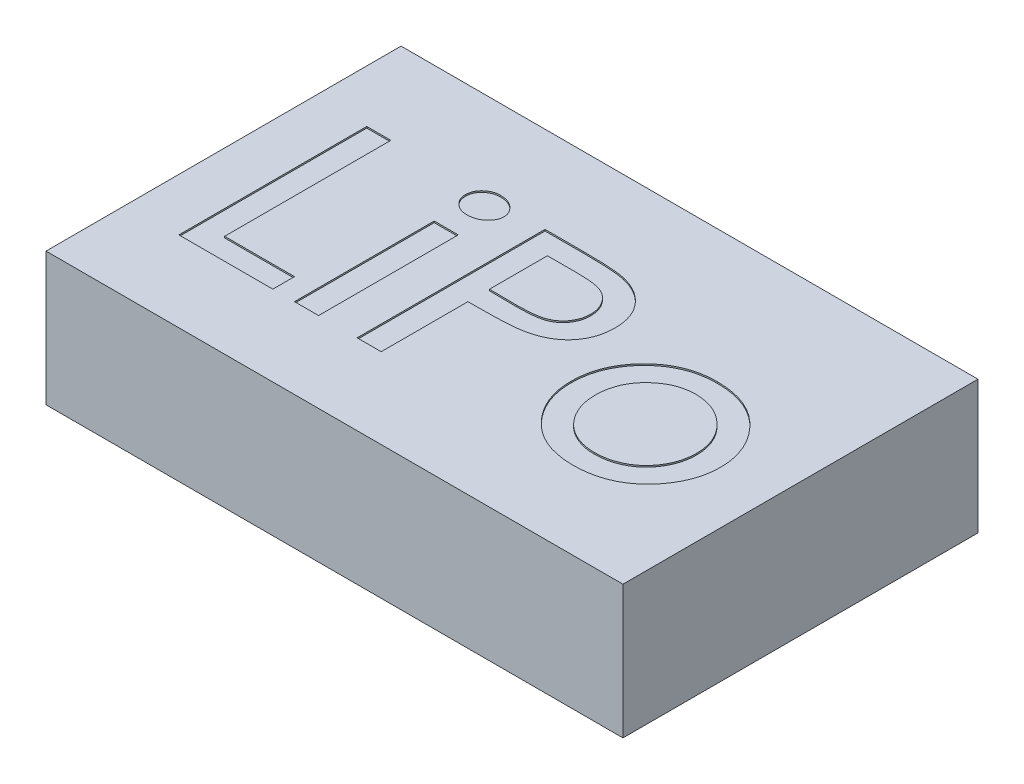
from build123d import *

# Parameters (mm, degrees)
SKETCH1_W           = 39
SKETCH1_H           = 24
BOSS_EXTRUDE1_DEPTH = 9
SKETCH2_W           = 1.628205129
SKETCH2_H           = 9.443589744
CUT_EXTRUDE1_DEPTH  = 0.1


with BuildPart() as part:
    # Sketch1 → Boss-Extrude1 (new body)
    with BuildSketch(Plane(origin=(0, 0, 0), x_dir=(1, 0, 0), z_dir=(0, 1, 0))):
        Rectangle(SKETCH1_W, SKETCH1_H)
    extrude(amount=BOSS_EXTRUDE1_DEPTH)

    # Sketch2 → Cut-Extrude1 (cut)
    # profile 1 of 5: a face of its own
    with BuildSketch(Plane(origin=(0, 9, 0), x_dir=(1, 0, 0), z_dir=(0, 1, 0))):
        Polygon((-15.955841103, 6.138342884), (-14.327635975, 6.138342884), (-14.327635975, -5.0962725), (-9.605841103, -5.0962725), (-9.605841103, -6.561657116), (-15.955841103, -6.561657116), align=None)
    # profile 2 of 5: a face of its own
    with BuildSketch(Plane(origin=(0, 9, 0), x_dir=(1, 0, 0), z_dir=(0, 1, 0))):
        with BuildLine():
            add(Edge.make_bspline(
                [(-7.412852321, 6.626804423), (-7.314947287, 6.622516885), (-7.126055311, 6.614244772), (-6.85683311, 6.54771702), (-6.616185839, 6.433306505), (-6.411180505, 6.275676826), (-6.241281957, 6.095125823), (-6.115492612, 5.900100689), (-6.039852549, 5.693335838), (-6.029118096, 5.552085378), (-6.023789821, 5.481972692)],
                knots=[0, 0, 0, 0, 1.180073081, 2.27676073, 3.320042968, 4.371717959, 5.377874923, 6.297457691, 7.154906711, 8, 8, 8, 8], degree=3))
            add(Edge.make_bspline(
                [(-6.023789821, 5.481972692), (-6.029128476, 5.412709036), (-6.039888104, 5.273113724), (-6.115478932, 5.068725668), (-6.242237258, 4.876313988), (-6.410279893, 4.695608672), (-6.617105321, 4.541182808), (-6.856704768, 4.426239487), (-7.126090975, 4.359922789), (-7.314959462, 4.351620449), (-7.412852321, 4.347317243)],
                knots=[0, 0, 0, 0, 0.838561902, 1.690053866, 2.604955955, 3.615478493, 4.665551833, 5.713360726, 6.814806749, 8, 8, 8, 8], degree=3))
            add(Edge.make_bspline(
                [(-7.412852321, 4.347317243), (-7.493941338, 4.350609069), (-7.652023482, 4.357026446), (-7.878018058, 4.425735513), (-8.088546328, 4.527203374), (-8.27435352, 4.672872337), (-8.431180106, 4.844933142), (-8.547668249, 5.040762236), (-8.615557241, 5.256259261), (-8.624422943, 5.406033992), (-8.628918026, 5.481972692)],
                knots=[0, 0, 0, 0, 1.050897616, 2.04871332, 3.044517726, 4.074156936, 5.096691018, 6.055190702, 7.01394389, 8, 8, 8, 8], degree=3))
            add(Edge.make_bspline(
                [(-8.628918026, 5.481972692), (-8.62461053, 5.559648736), (-8.616205957, 5.711206412), (-8.547003827, 5.928738293), (-8.432039544, 6.126265696), (-8.27435621, 6.298871144), (-8.087862744, 6.443782083), (-7.87805563, 6.549548832), (-7.650945016, 6.61633204), (-7.493026045, 6.623278023), (-7.412852321, 6.626804423)],
                knots=[0, 0, 0, 0, 1.003476519, 1.957934027, 2.921620235, 3.939572868, 4.964598795, 5.960849032, 6.964745478, 8, 8, 8, 8], degree=3))
        make_face()
    # profile 3 of 5: a face of its own
    with BuildSketch(Plane(origin=(0, 9, 0), x_dir=(1, 0, 0), z_dir=(0, 1, 0))):
        with Locations((-7.326353924, -1.839862244)):
            Rectangle(SKETCH2_W, SKETCH2_H)
    # profile 4 of 5: a face of its own
    with BuildSketch(Plane(origin=(0, 9, 0), x_dir=(1, 0, 0), z_dir=(0, 1, 0))):
        with BuildLine():
            Line((-3.907123154, 6.138342884), (-1.30453902, 6.138342884))
            add(Edge.make_bspline(
                [(-1.30453902, 6.138342884), (-1.132380236, 6.138249095), (-0.80244535, 6.138069353), (-0.329283438, 6.125889402), (0.099980962, 6.115377096), (0.485982113, 6.095171544), (0.827841185, 6.06749381), (1.125680897, 6.034948112), (1.379821044, 5.998343192), (1.533087469, 5.965249426), (1.603333577, 5.950081666)],
                knots=[0, 0, 0, 0, 1.415450773, 2.712650385, 3.891531898, 4.945867971, 5.890285756, 6.71109784, 7.409261617, 8, 8, 8, 8], degree=3))
            add(Edge.make_bspline(
                [(1.603333577, 5.950081666), (1.702221625, 5.924652046), (1.897297433, 5.874487199), (2.176165559, 5.771082614), (2.440773739, 5.653584619), (2.690218552, 5.519926675), (2.921952019, 5.365558917), (3.140973672, 5.197840764), (3.340546734, 5.008289271), (3.527508414, 4.806099999), (3.69154967, 4.586654785), (3.838531109, 4.357378993), (3.960356367, 4.114942457), (4.060476117, 3.860246958), (4.138743346, 3.594620425), (4.195042094, 3.317216532), (4.228871403, 3.028643583), (4.232204741, 2.83199178), (4.233902487, 2.731832468)],
                knots=[0, 0, 0, 0, 1.085641105, 2.141637125, 3.15936318, 4.164535163, 5.147931294, 6.118832473, 7.09541784, 8.072503165, 9.045079613, 10.006206652, 10.966486436, 11.926469503, 12.914201526, 13.908586125, 14.934794539, 16, 16, 16, 16], degree=3))
            add(Edge.make_bspline(
                [(4.233902487, 2.731832468), (4.232167493, 2.631677822), (4.228746424, 2.43419241), (4.195130741, 2.143894332), (4.138780974, 1.865914168), (4.062810983, 1.599023888), (3.962969562, 1.344883326), (3.843667329, 1.10134694), (3.699453807, 0.871173941), (3.534817067, 0.65276668), (3.348895207, 0.449481612), (3.14438275, 0.262090322), (2.918591443, 0.093865528), (2.673837038, -0.058212234), (2.410972387, -0.196809727), (2.127353046, -0.316018783), (1.82424438, -0.417596253), (1.613880128, -0.471607777), (1.506658897, -0.499137084)],
                knots=[0, 0, 0, 0, 1.042501879, 2.055610221, 3.037454288, 3.993184118, 4.940927036, 5.876790881, 6.812738028, 7.76458517, 8.720845088, 9.677105007, 10.648370915, 11.647960469, 12.67482723, 13.739162042, 14.847666245, 16, 16, 16, 16], degree=3))
            add(Edge.make_bspline(
                [(1.506658897, -0.499137084), (1.42796686, -0.516198084), (1.256301805, -0.553416304), (0.971433974, -0.592144527), (0.6395048, -0.623872974), (0.2594652, -0.651477311), (-0.167127049, -0.674665201), (-0.642164129, -0.688468396), (-1.164562619, -0.699606551), (-1.529257942, -0.699943265), (-1.719222513, -0.700118654)],
                knots=[0, 0, 0, 0, 0.596754895, 1.30180848, 2.129432098, 3.068723067, 4.126429569, 5.296393252, 6.591729958, 8, 8, 8, 8], degree=3))
            Line((-1.719222513, -0.700118654), (-2.278918026, -0.700118654))
            Line((-2.278918026, -0.700118654), (-2.278918026, -6.561657116))
            Line((-2.278918026, -6.561657116), (-3.907123154, -6.561657116))
            Line((-3.907123154, -6.561657116), (-3.907123154, 6.138342884))
        make_face()
        with BuildLine():
            Line((-2.278918026, 4.672958269), (-2.278918026, 0.76017782))
            Line((-2.278918026, 0.76017782), (-0.447187257, 0.739825256))
            add(Edge.make_bspline(
                [(-0.447187257, 0.739825256), (-0.343724521, 0.741189549), (-0.144384409, 0.743818113), (0.143278951, 0.752944795), (0.407868149, 0.771494159), (0.649894285, 0.793127937), (0.86984628, 0.823458595), (1.066733929, 0.861312724), (1.242236035, 0.903843887), (1.442925191, 0.970712291), (1.667565353, 1.07512201), (1.906382383, 1.234429645), (2.116891362, 1.424949837), (2.290740032, 1.649191731), (2.430646241, 1.896262172), (2.534642058, 2.160334862), (2.593505562, 2.440920668), (2.601598996, 2.632351462), (2.605697359, 2.729288397)],
                knots=[0, 0, 0, 0, 1.196816259, 2.305888068, 3.328295896, 4.264290022, 5.116006351, 5.89509982, 6.582615619, 7.202969204, 8.339503699, 9.435837163, 10.511976311, 11.608836183, 12.702577786, 13.786378287, 14.879063815, 16, 16, 16, 16], degree=3))
            add(Edge.make_bspline(
                [(2.605697359, 2.729288397), (2.601569392, 2.822842482), (2.593381725, 3.00840349), (2.534210526, 3.281316516), (2.430166713, 3.540182969), (2.290032625, 3.783782729), (2.119743381, 4.006436562), (1.918027671, 4.19797391), (1.689741324, 4.354513278), (1.476618456, 4.454773978), (1.286586629, 4.520021785), (1.119100896, 4.558350318), (0.929893189, 4.594186963), (0.717788583, 4.62490905), (0.482589749, 4.647066324), (0.224580209, 4.661279016), (-0.055304695, 4.672416889), (-0.249585013, 4.672773178), (-0.350512577, 4.672958269)],
                knots=[0, 0, 0, 0, 1.113934591, 2.209447376, 3.306634974, 4.424089692, 5.547326231, 6.633252657, 7.723023745, 8.829884498, 9.427152571, 10.113060991, 10.873719268, 11.720735618, 12.664423995, 13.686322671, 14.798057257, 16, 16, 16, 16], degree=3))
            Line((-0.350512577, 4.672958269), (-2.278918026, 4.672958269))
        make_face(mode=Mode.SUBTRACT)
    # profile 5 of 5: a face of its own
    with BuildSketch(Plane(origin=(0, 9, 0), x_dir=(1, 0, 0), z_dir=(0, 1, 0))):
        with BuildLine():
            add(Edge.make_bspline(
                [(10.833221397, 3.044753141), (11.02168919, 3.039591974), (11.390673557, 3.029487384), (11.93059497, 2.958396807), (12.443305191, 2.83487933), (12.930273683, 2.665823133), (13.389496324, 2.444335931), (13.822120099, 2.176374666), (14.226598259, 1.856728947), (14.470240772, 1.611633183), (14.593357615, 1.487781987)],
                knots=[0, 0, 0, 0, 1.078775739, 2.112039281, 3.110494877, 4.093081892, 5.057110616, 6.022958758, 7.000966324, 8, 8, 8, 8], degree=3))
            add(Edge.make_bspline(
                [(14.593357615, 1.487781987), (14.702537199, 1.365023521), (14.917192776, 1.123670805), (15.194551026, 0.734357418), (15.430755599, 0.333874791), (15.621851439, -0.080796314), (15.77416863, -0.507759693), (15.879801705, -0.948702421), (15.946321434, -1.402790317), (15.953397958, -1.709882552), (15.95697941, -1.865302949)],
                knots=[0, 0, 0, 0, 1.062178036, 2.088324843, 3.086640365, 4.066023852, 5.037709567, 6.014384934, 6.995073642, 8, 8, 8, 8], degree=3))
            add(Edge.make_bspline(
                [(15.95697941, -1.865302949), (15.952503115, -2.021580942), (15.943631721, -2.331302201), (15.874962033, -2.788826527), (15.766359672, -3.234164207), (15.610132198, -3.66528214), (15.409071094, -4.082648101), (15.167859051, -4.488800898), (14.877034745, -4.878334742), (14.550046388, -5.252379053), (14.186669732, -5.597450965), (13.790105331, -5.899558131), (13.365214743, -6.155221201), (12.912765183, -6.365667189), (12.430598858, -6.524687274), (11.923386618, -6.642451584), (11.387215336, -6.711999012), (11.020839753, -6.720251558), (10.833221397, -6.724477629)],
                knots=[0, 0, 0, 0, 0.952871876, 1.888459614, 2.815544184, 3.744891397, 4.679563604, 5.637601804, 6.621431805, 7.640342292, 8.664856555, 9.672479278, 10.67487095, 11.683873433, 12.709444777, 13.765907845, 14.855937143, 16, 16, 16, 16], degree=3))
            add(Edge.make_bspline(
                [(10.833221397, -6.724477629), (10.654037532, -6.720362131), (10.302785279, -6.712294564), (9.789498307, -6.640672203), (9.300041386, -6.531368402), (8.837983978, -6.368756331), (8.399519684, -6.16540674), (7.987581624, -5.913192006), (7.598996887, -5.618112515), (7.243902097, -5.276704072), (6.92024349, -4.909677749), (6.639312995, -4.520030604), (6.397686298, -4.116821566), (6.201247273, -3.696640072), (6.050713224, -3.259637195), (5.940493306, -2.809419267), (5.876129411, -2.342048305), (5.86682732, -2.025774364), (5.862107615, -1.865302949)],
                knots=[0, 0, 0, 0, 1.108842573, 2.173652473, 3.202745058, 4.208988794, 5.200203338, 6.189803525, 7.193715926, 8.215010613, 9.234454675, 10.219573757, 11.184848795, 12.140854958, 13.08565054, 14.042002664, 15.006549187, 16, 16, 16, 16], degree=3))
            add(Edge.make_bspline(
                [(5.862107615, -1.865302949), (5.865951588, -1.706536323), (5.873524976, -1.393734654), (5.935606572, -0.932516511), (6.040939812, -0.489353416), (6.182936513, -0.060658898), (6.370442315, 0.35030289), (6.598401088, 0.745850886), (6.864751373, 1.127445533), (7.072375238, 1.361675493), (7.17739207, 1.480149775)],
                knots=[0, 0, 0, 0, 1.034079547, 2.037341334, 3.024980457, 3.998111168, 4.974764182, 5.962233312, 6.969290918, 8, 8, 8, 8], degree=3))
            add(Edge.make_bspline(
                [(7.17739207, 1.480149775), (7.299562542, 1.604949855), (7.540414603, 1.850986039), (7.941309947, 2.169971537), (8.364275349, 2.441949277), (8.813566123, 2.660648571), (9.283938755, 2.836367604), (9.780014827, 2.95747242), (10.29939049, 3.029466809), (10.653209991, 3.039598486), (10.833221397, 3.044753141)],
                knots=[0, 0, 0, 0, 1.021997278, 2.014808882, 2.992991082, 3.961403697, 4.935644248, 5.92819495, 6.945935601, 8, 8, 8, 8], degree=3))
        make_face()
        with BuildLine():
            add(Edge.make_bspline(
                [(10.828133256, 1.579368525), (10.719423659, 1.576471742), (10.503574952, 1.570720024), (10.185647478, 1.523654155), (9.876636064, 1.447544319), (9.579931598, 1.33704577), (9.291055597, 1.198955934), (9.014862945, 1.026959363), (8.74512902, 0.828036408), (8.49167343, 0.597688982), (8.255858297, 0.346922153), (8.051543552, 0.074973876), (7.876758002, -0.210531017), (7.736780336, -0.513196312), (7.626181593, -0.830967403), (7.548793999, -1.164454861), (7.497787452, -1.513501752), (7.49283846, -1.751482022), (7.490312743, -1.872935161)],
                knots=[0, 0, 0, 0, 0.976916649, 1.939720157, 2.882730922, 3.833047911, 4.780976627, 5.756404754, 6.753607, 7.790049989, 8.831165002, 9.84360893, 10.842529111, 11.835057585, 12.835634664, 13.861933882, 14.908838789, 16, 16, 16, 16], degree=3))
            add(Edge.make_bspline(
                [(7.490312743, -1.872935161), (7.496095687, -2.031115987), (7.507476673, -2.342420054), (7.600475791, -2.798401425), (7.748070365, -3.234183089), (7.954142983, -3.644078782), (8.206060393, -4.019085602), (8.499709472, -4.347383598), (8.823862317, -4.631586055), (9.184777122, -4.859811417), (9.570079518, -5.038441141), (9.974554713, -5.165608951), (10.395921924, -5.245086393), (10.682769835, -5.254382238), (10.828133256, -5.259093013)],
                knots=[0, 0, 0, 0, 1.073737222, 2.11314337, 3.147909503, 4.191315005, 5.220292011, 6.207728104, 7.175628903, 8.139268678, 9.098074859, 10.052770626, 11.013219503, 12, 12, 12, 12], degree=3))
            add(Edge.make_bspline(
                [(10.828133256, -5.259093013), (10.985382136, -5.253720203), (11.295249366, -5.243132797), (11.749092498, -5.158985414), (12.18251169, -5.02387711), (12.592469924, -4.835575572), (12.972932607, -4.597023273), (13.313146125, -4.307503011), (13.611313999, -3.971814557), (13.866620883, -3.597637855), (14.072792125, -3.191654202), (14.220811942, -2.765575456), (14.310593955, -2.32357651), (14.322667889, -2.024296196), (14.328774282, -1.872935161)],
                knots=[0, 0, 0, 0, 1.042880454, 2.055051067, 3.051726387, 4.048830532, 5.040201766, 6.022282375, 7.002717173, 8.011000956, 9.020163719, 10.014978664, 10.996075346, 12, 12, 12, 12], degree=3))
            add(Edge.make_bspline(
                [(14.328774282, -1.872935161), (14.326120983, -1.755735267), (14.320886997, -1.524542779), (14.270931294, -1.184394715), (14.189854146, -0.856860237), (14.074641909, -0.543402197), (13.928743162, -0.242930175), (13.749232728, 0.043274897), (13.536746589, 0.316577263), (13.294517016, 0.572553597), (13.031938215, 0.807912413), (12.754489598, 1.015761557), (12.462740549, 1.188387612), (12.160734755, 1.333861262), (11.84421213, 1.441961054), (11.516425575, 1.521156496), (11.176537911, 1.571585008), (10.945337279, 1.576750134), (10.828133256, 1.579368525)],
                knots=[0, 0, 0, 0, 1.02928639, 2.030405262, 3.013559112, 3.98951401, 4.959304921, 5.943474834, 6.952548865, 7.996299005, 9.035918103, 10.047849461, 11.03697177, 12.01024899, 12.98822153, 13.969594738, 14.97071361, 16, 16, 16, 16], degree=3))
        make_face(mode=Mode.SUBTRACT)
    extrude(amount=-CUT_EXTRUDE1_DEPTH, mode=Mode.SUBTRACT)


solid = part.part
